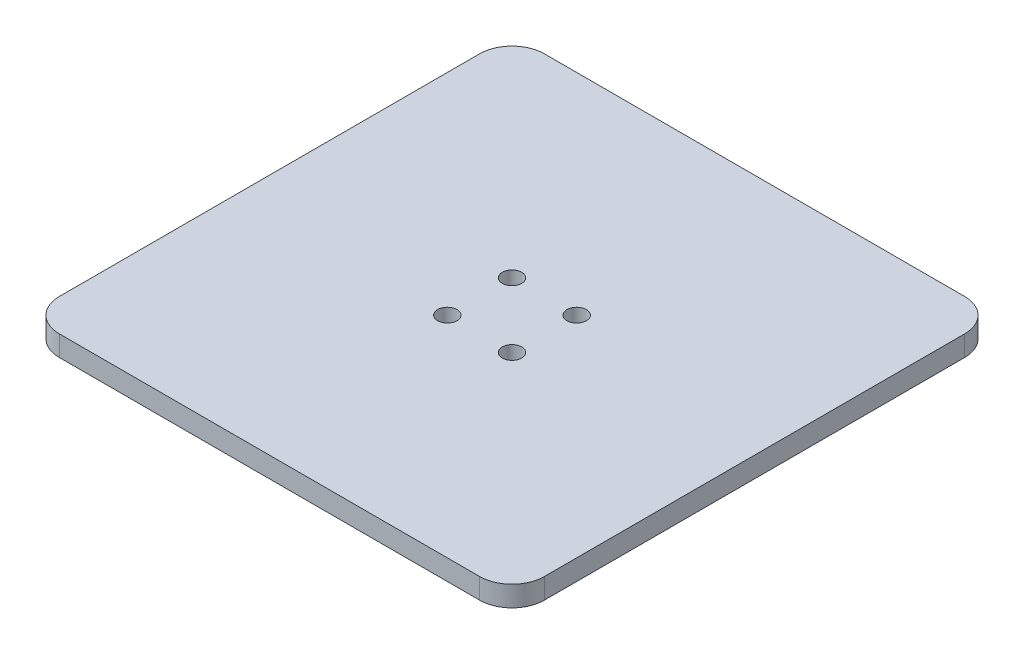
from build123d import *

# Parameters (mm, degrees)
SKETCH2_W           = 150
SKETCH2_H           = 150
SKETCH2_R           = 1.25
BOSS_EXTRUDE1_DEPTH = 6.35
FILLET1_R           = 10
SKETCH3_R           = 3
CUT_EXTRUDE1_DEPTH  = 4.3
BOSS_EXTRUDE2_START = 9
SKETCH4_W           = 32.2
SKETCH4_H           = 30
SKETCH4_R           = 1.25
BOSS_EXTRUDE2_DEPTH = 9


with BuildPart() as part:
    # Sketch2 → Boss-Extrude1 (new body)
    with BuildSketch(Plane(origin=(0, 0, 0), x_dir=(1, 0, 0), z_dir=(0, 1, 0))):
        with Locations((-75, 75)):
            Rectangle(SKETCH2_W, SKETCH2_H)
        with Locations(Location((-85, 85, 0), (0, 0, 270))):
            Circle(SKETCH2_R, mode=Mode.SUBTRACT)
        with Locations(Location((-65, 85, 0), (0, 0, 270))):
            Circle(SKETCH2_R, mode=Mode.SUBTRACT)
        with Locations(Location((-85, 65, 0), (0, 0, 270))):
            Circle(SKETCH2_R, mode=Mode.SUBTRACT)
        with Locations(Location((-65, 65, 0), (0, 0, 270))):
            Circle(SKETCH2_R, mode=Mode.SUBTRACT)
    extrude(amount=BOSS_EXTRUDE1_DEPTH)

    # Fillet1
    fillet1_edges = [part.edges().sort_by_distance(p)[0] for p in [
        (0, 3.175, 0),
        (-150, 3.175, 0),
        (-150, 3.175, -150),
        (0, 3.175, -150),
    ]]
    fillet(fillet1_edges, radius=FILLET1_R)

    # Sketch3 → Cut-Extrude1 (cut)
    with BuildSketch(Plane(origin=(0, 6.35, 0), x_dir=(1, 0, 0), z_dir=(0, 1, 0))):
        with Locations(Location((-85, 85, 0), (0, 0, 270))):
            Circle(SKETCH3_R)
        with Locations(Location((-65, 85, 0), (0, 0, 270))):
            Circle(SKETCH3_R)
        with Locations(Location((-85, 65, 0), (0, 0, 270))):
            Circle(SKETCH3_R)
        with Locations(Location((-65, 65, 0), (0, 0, 270))):
            Circle(SKETCH3_R)
    extrude(amount=-CUT_EXTRUDE1_DEPTH, mode=Mode.SUBTRACT)

    # Sketch4 → Boss-Extrude2 (add)
    with BuildSketch(Plane.XZ.offset(BOSS_EXTRUDE2_START)):
        with Locations((-75, -75)):
            Rectangle(SKETCH4_W, SKETCH4_H)
        with Locations(Location((-85, -65, 0), (0, 0, 270))):
            Circle(SKETCH4_R, mode=Mode.SUBTRACT)
        with Locations(Location((-85, -85, 0), (0, 0, 270))):
            Circle(SKETCH4_R, mode=Mode.SUBTRACT)
        with Locations(Location((-65, -85, 0), (0, 0, 270))):
            Circle(SKETCH4_R, mode=Mode.SUBTRACT)
        with Locations(Location((-65, -65, 0), (0, 0, 270))):
            Circle(SKETCH4_R, mode=Mode.SUBTRACT)
    extrude(amount=-BOSS_EXTRUDE2_DEPTH)


solid = part.part
